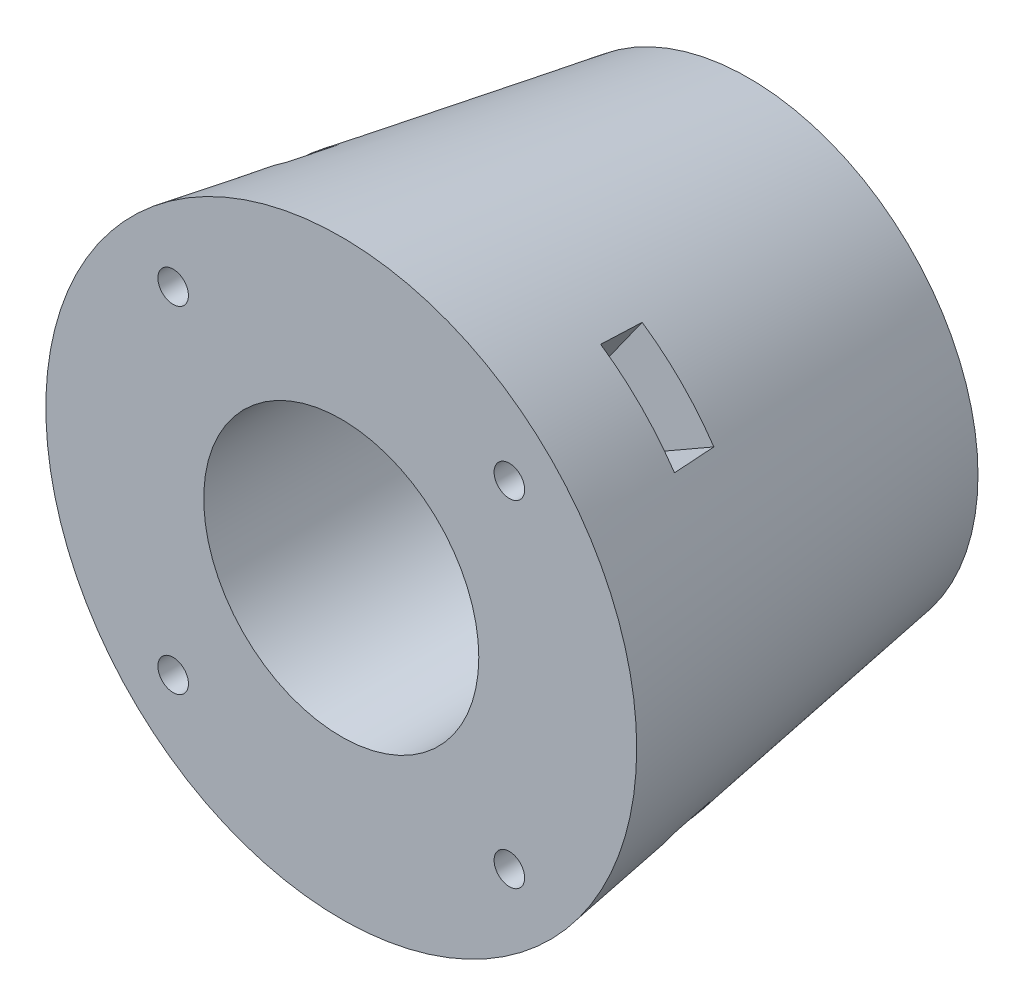
from build123d import *

# Parameters (mm, degrees)
SKETCH1_R           = 29
BOSS_EXTRUDE1_DEPTH = 40
BOSS_EXTRUDE1_DRAFT = -9.23
SKETCH2_R           = 1.5
CUT_EXTRUDE1_DEPTH  = 10
SKETCH4_R           = 13.5
CUT_EXTRUDE3_DEPTH  = 35
SKETCH5_R           = 1.6
CUT_EXTRUDE4_DEPTH  = 35
CUT_EXTRUDE5_DEPTH  = 4.5


with BuildPart() as part:
    # Sketch1 → Boss-Extrude1 (with draft: the straight prism first)
    with BuildSketch(Plane.XY):
        Circle(SKETCH1_R)
    extrude(amount=-BOSS_EXTRUDE1_DEPTH)
    # Boss-Extrude1: the draft: its side faces are tilted about the plane it starts from
    boss_extrude1_sides = [part.faces().sort_by_distance(p)[0] for p in [
        (-29, 0, -20),
    ]]
    draft(boss_extrude1_sides, Plane.XY, BOSS_EXTRUDE1_DRAFT)

    # Sketch2 → Cut-Extrude1 (cut)
    with BuildSketch(Plane.XY):
        with Locations((-16.5, 16.5)):
            Circle(SKETCH2_R)
        with Locations(Location((16.5, 16.5, 0), (0, 0, 180))):
            Circle(SKETCH2_R)
        with Locations((16.5, -16.5)):
            Circle(SKETCH2_R)
        with Locations(Location((-16.5, -16.5, 0), (0, 0, 180))):
            Circle(SKETCH2_R)
    extrude(amount=-CUT_EXTRUDE1_DEPTH, mode=Mode.SUBTRACT)

    # Sketch4 → Cut-Extrude3 (cut)
    with BuildSketch(Plane.XY):
        Circle(SKETCH4_R)
    extrude(amount=-CUT_EXTRUDE3_DEPTH, mode=Mode.SUBTRACT)

    # Sketch5 → Cut-Extrude4 (cut)
    with BuildSketch(Plane.XY.offset(-35)):
        with Locations((7, 0)):
            Circle(SKETCH5_R)
        with Locations((-3.5, -6.062177826)):
            Circle(SKETCH5_R)
        with Locations((-3.5, 6.062177826)):
            Circle(SKETCH5_R)
    extrude(amount=-CUT_EXTRUDE4_DEPTH, mode=Mode.SUBTRACT)

    # Sketch6 → Cut-Extrude5 (cut)
    with BuildSketch(Plane.XY.offset(-10)):
        with BuildLine():
            Line((11.668923699, 17.275154255), (17.761390964, 25.810687075))
            ThreePointArc((17.761390964, 25.810687075), (22.367192771, 21.940083496), (26.14828814, 17.260521534))
            Line((26.14828814, 17.260521534), (17.027183551, 12.027874092))
            ThreePointArc((17.027183551, 12.027874092), (14.585956606, 14.894448789), (11.668923699, 17.275154255))
        make_face()
        with BuildLine():
            Line((12.027874092, -17.027183551), (17.260521534, -26.14828814))
            ThreePointArc((17.260521534, -26.14828814), (21.940083496, -22.367192771), (25.810687075, -17.761390964))
            Line((25.810687075, -17.761390964), (17.275154255, -11.668923699))
            ThreePointArc((17.275154255, -11.668923699), (14.894448789, -14.585956606), (12.027874092, -17.027183551))
        make_face()
        with BuildLine():
            Line((-17.027183551, -12.027874092), (-26.14828814, -17.260521534))
            ThreePointArc((-26.14828814, -17.260521534), (-22.367192771, -21.940083496), (-17.761390964, -25.810687075))
            Line((-17.761390964, -25.810687075), (-11.668923699, -17.275154255))
            ThreePointArc((-11.668923699, -17.275154255), (-14.585956606, -14.894448789), (-17.027183551, -12.027874092))
        make_face()
        with BuildLine():
            Line((-12.027874092, 17.027183551), (-17.260521534, 26.14828814))
            ThreePointArc((-17.260521534, 26.14828814), (-21.940083496, 22.367192771), (-25.810687075, 17.761390964))
            Line((-25.810687075, 17.761390964), (-17.275154255, 11.668923699))
            ThreePointArc((-17.275154255, 11.668923699), (-14.894448789, 14.585956606), (-12.027874092, 17.027183551))
        make_face()
    extrude(amount=-CUT_EXTRUDE5_DEPTH, mode=Mode.SUBTRACT)


solid = part.part
